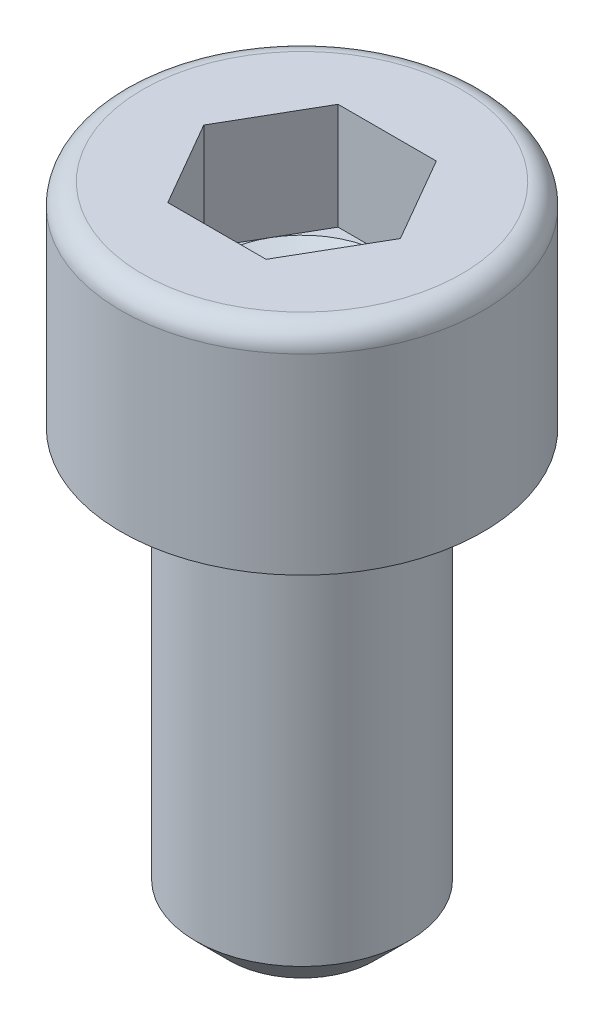
from build123d import *

# Parameters (mm, degrees)
TIGE_START              = -10
ESQUISSE1_R             = 2.5
TIGE_DEPTH              = 10
CHANFREIN_D_ENTR_E_SIZE = 0.8
HEXAGONE_DEPTH          = 2.5


with BuildPart() as part:
    # Esquisse1 → Tige (new body)
    with BuildSketch(Plane(origin=(0, 0, 0), x_dir=(1, 0, 0), z_dir=(0, 1, 0)).offset(TIGE_START)):
        with Locations(Location((0, 0, 0), (0, 0, 270))):
            Circle(ESQUISSE1_R)
    extrude(amount=TIGE_DEPTH)

    # Chanfrein d'entrée
    chanfrein_d_entr_e_edges = [part.edges().sort_by_distance(p)[0] for p in [
        (0, -10, -2.5),
    ]]
    chamfer(chanfrein_d_entr_e_edges, length=CHANFREIN_D_ENTR_E_SIZE)

    # Esquisse2 → Tête (revolve)
    with BuildSketch(Plane.XY, mode=Mode.PRIVATE) as t_te_sk:
        with BuildLine():
            Line((2, 5), (2, 2.5))
            Line((2, 2.5), (0, 1.345299462))
            Line((0, 1.345299462), (0, 0))
            Line((0, 0), (4.25, 0))
            Line((4.25, 0), (4.25, 4.5))
            ThreePointArc((4.25, 4.5), (4.103553391, 4.853553391), (3.75, 5))
            Line((3.75, 5), (2, 5))
        make_face()
    revolve(t_te_sk.sketch.rotate(Axis((0, 5, 0), (0, -1, 0)), 180), axis=Axis((0, 5, 0), (0, -1, 0)))

    # Esquisse3 → Hexagone (cut)
    with BuildSketch(Plane(origin=(0, 5, -3), x_dir=(1, 0, 0), z_dir=(0, -1, 0))):
        Polygon((1.154700538, 5), (-1.154700538, 5), (-2.309401077, 3), (-1.154700538, 1), (1.154700538, 1), (2.309401077, 3), align=None)
    extrude(amount=HEXAGONE_DEPTH, mode=Mode.SUBTRACT)


solid = part.part
